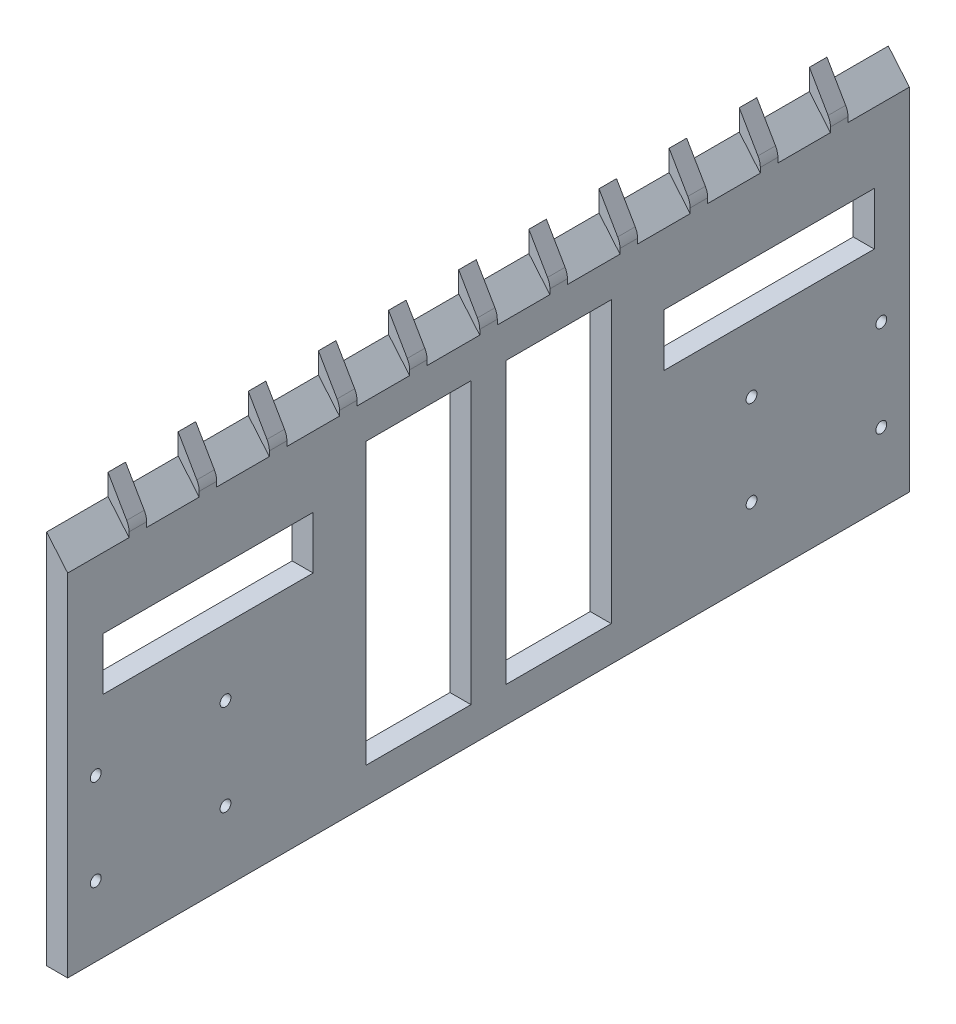
from build123d import *

# Parameters (mm, degrees)
SKETCH_1_W                 = 240
SKETCH_1_H                 = 100
EXTRUDE_1_DEPTH            = 6
SKETCH_2_R                 = 1.55
CUT_EXTRUDE_1_DEPTH        = 261.069221555
SKETCH_3_W                 = 60
SKETCH_3_H                 = 15
CUT_EXTRUDE_2_DEPTH        = 261.069221555
SKETCH_4_W                 = 30
SKETCH_4_H                 = 80
CUT_EXTRUDE_3_DEPTH        = 261.069221555
SKETCH_5_R                 = 3
CUT_EXTRUDE_4_DEPTH        = 3
EXTRUDE_2_DEPTH            = 240
EXTRUDE_3_DEPTH            = 5
PATTERN_LINEAR_1_COUNT     = 6
PATTERN_LINEAR_1_PITCH     = 20
PATTERN_LINEAR_1_COL_COUNT = 6
PATTERN_LINEAR_1_COL_PITCH = 20
FILLET_1_R                 = 5


with BuildPart() as part:
    # 草图1 → 凸台-拉伸1 (new body)
    with BuildSketch(Plane(origin=(0, 0, 0), x_dir=(0, 0, -1), z_dir=(1, 0, 0))):
        with Locations((120, -50)):
            Rectangle(SKETCH_1_W, SKETCH_1_H)
    extrude(amount=EXTRUDE_1_DEPTH)

    # 草图2 → 切除-拉伸1 (cut, through all)
    with BuildSketch(Plane(origin=(6, 0, 0), x_dir=(0, 0, -1), z_dir=(1, 0, 0))):
        with Locations((8, -54)):
            Circle(SKETCH_2_R)
        with Locations((45, -80)):
            Circle(SKETCH_2_R)
        with Locations((45, -54)):
            Circle(SKETCH_2_R)
        with Locations((8, -80)):
            Circle(SKETCH_2_R)
        with Locations(Location((232, -80, 0), (0, 0, 180))):
            Circle(SKETCH_2_R)
        with Locations(Location((195, -54, 0), (0, 0, 180))):
            Circle(SKETCH_2_R)
        with Locations(Location((195, -80, 0), (0, 0, 180))):
            Circle(SKETCH_2_R)
        with Locations(Location((232, -54, 0), (0, 0, 180))):
            Circle(SKETCH_2_R)
    extrude(amount=-CUT_EXTRUDE_1_DEPTH, mode=Mode.SUBTRACT)

    # 草图3 → 切除-拉伸2 (cut, through all)
    with BuildSketch(Plane(origin=(6, 0, 0), x_dir=(0, 0, -1), z_dir=(1, 0, 0))):
        with Locations((40, -27.5)):
            Rectangle(SKETCH_3_W, SKETCH_3_H)
        with Locations((200, -27.5)):
            Rectangle(SKETCH_3_W, SKETCH_3_H)
    extrude(amount=-CUT_EXTRUDE_2_DEPTH, mode=Mode.SUBTRACT)

    # 草图4 → 切除-拉伸3 (cut, through all)
    with BuildSketch(Plane(origin=(6, 0, 0), x_dir=(0, 0, -1), z_dir=(1, 0, 0))):
        with Locations((100, -50)):
            Rectangle(SKETCH_4_W, SKETCH_4_H)
        with Locations((140, -50)):
            Rectangle(SKETCH_4_W, SKETCH_4_H)
    extrude(amount=-CUT_EXTRUDE_3_DEPTH, mode=Mode.SUBTRACT)

    # 草图5 → 切除-拉伸4 (cut)
    with BuildSketch(Plane.ZY):
        with Locations((-195, -80)):
            Circle(SKETCH_5_R)
        with Locations((-232, -80)):
            Circle(SKETCH_5_R)
        with Locations((-195, -54)):
            Circle(SKETCH_5_R)
        with Locations((-232, -54)):
            Circle(SKETCH_5_R)
        with Locations((-45, -80)):
            Circle(SKETCH_5_R)
        with Locations((-8, -80)):
            Circle(SKETCH_5_R)
        with Locations((-8, -54)):
            Circle(SKETCH_5_R)
        with Locations((-45, -54)):
            Circle(SKETCH_5_R)
    extrude(amount=-CUT_EXTRUDE_4_DEPTH, mode=Mode.SUBTRACT)

    # 草图6 → 凸台-拉伸2 (add)
    with BuildSketch(Plane.XY):
        Polygon((6, 0), (0, 0), (0, 7.150521556), align=None)
    extrude(amount=-EXTRUDE_2_DEPTH)

    # 草图7 → 凸台-拉伸3 (add)
    with BuildSketch(Plane.XY.offset(-117.5)):
        Polygon((0, 7.150521556), (0, 13.150521556), (6, 2.75821671), (6, 0), align=None)
    extrude_3 = extrude(amount=-EXTRUDE_3_DEPTH)

    # 阵列(线性)1: 凸台-拉伸3 ×6
    with Locations(*[(0, 0, -i * PATTERN_LINEAR_1_PITCH) for i in range(1, PATTERN_LINEAR_1_COUNT)]):
        add(extrude_3)

    # 阵列(线性)1 col: 凸台-拉伸3 ×6
    with Locations(*[(0, 0, i * PATTERN_LINEAR_1_COL_PITCH) for i in range(1, PATTERN_LINEAR_1_COL_COUNT)]):
        add(extrude_3)

    # 圆角1
    fillet_1_edges = [part.edges().sort_by_distance(p)[0] for p in [
        (6, 2.75821671, -120),
        (6, 2.75821671, -100),
        (6, 2.75821671, -80),
        (6, 2.75821671, -60),
        (6, 2.75821671, -40),
        (6, 2.75821671, -20),
        (6, 2.75821671, -140),
        (6, 2.75821671, -160),
        (6, 2.75821671, -180),
        (6, 2.75821671, -200),
        (6, 2.75821671, -220),
    ]]
    fillet(fillet_1_edges, radius=FILLET_1_R)


solid = part.part
